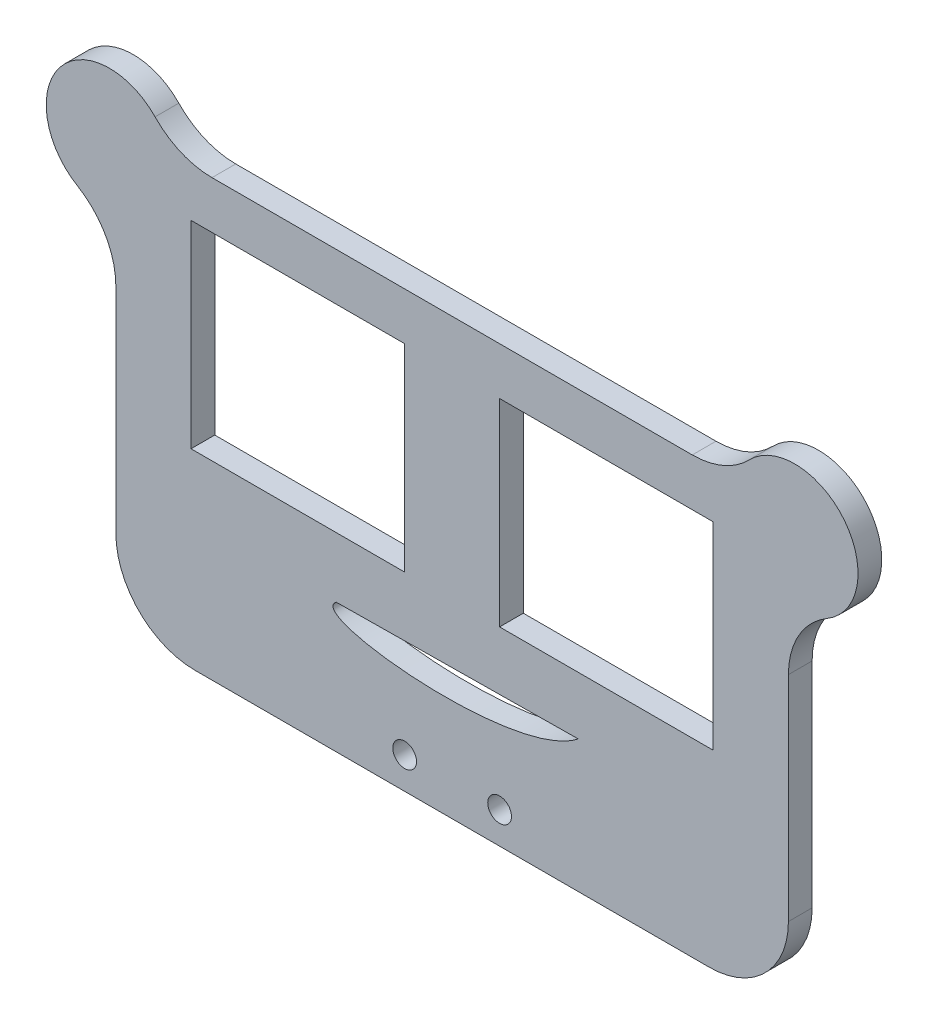
from build123d import *

# Parameters (mm, degrees)
SKETCH1_W               = 85
SKETCH1_H               = 55
BOSS_EXTRUDE2_DEPTH     = 3
CUT_EXTRUDE1_DEPTH      = 51.709959574
CUT_EXTRUDE1_DEPTH_BACK = 51.709959574
SKETCH3_W               = 27
SKETCH3_H               = 25
FILLET2_R               = 10
SKETCH4_R               = 8
BOSS_EXTRUDE3_DEPTH     = 3
FILLET3_R               = 10
CUT_EXTRUDE2_DEPTH      = 62.072254936
CUT_EXTRUDE2_DEPTH_BACK = 62.072254936
CUT_EXTRUDE3_DEPTH      = 62.072255079
CUT_EXTRUDE3_DEPTH_BACK = 62.072255079
SKETCH6_R               = 1.5


with BuildPart() as part:
    # Sketch1 → Boss-Extrude2 (new body)
    with BuildSketch(Plane.XY):
        Rectangle(SKETCH1_W, SKETCH1_H)
    extrude(amount=BOSS_EXTRUDE2_DEPTH)

    # Sketch3 → Cut-Extrude1 (cut, two sides: drawn at the far end of the back side and taken through both)
    with BuildSketch(Plane.XY.offset(3).offset(-CUT_EXTRUDE1_DEPTH_BACK)):
        with Locations((-19.5, 9)):
            Rectangle(SKETCH3_W, SKETCH3_H)
        with Locations((19.5, 9)):
            Rectangle(SKETCH3_W, SKETCH3_H)
    extrude(amount=CUT_EXTRUDE1_DEPTH + CUT_EXTRUDE1_DEPTH_BACK, mode=Mode.SUBTRACT)

    # Fillet2
    fillet2_edges = [part.edges().sort_by_distance(p)[0] for p in [
        (-42.5, -27.5, 1.5),
        (42.5, -27.5, 1.5),
    ]]
    fillet(fillet2_edges, radius=FILLET2_R)

    # Sketch4 → Boss-Extrude3 (add)
    with BuildSketch(Plane.XY):
        with Locations((-43.301270189, 25)):
            Circle(SKETCH4_R)
        with Locations((43.301270189, 25)):
            Circle(SKETCH4_R)
    extrude(amount=BOSS_EXTRUDE3_DEPTH)

    # Fillet3
    fillet3_edges = [part.edges().sort_by_distance(p)[0] for p in [
        (-35.701928112, 27.5, 1.5),
        (-42.5, 17.040228264, 1.5),
        (35.701928112, 27.5, 1.5),
        (42.5, 17.040228264, 1.5),
    ]]
    fillet(fillet3_edges, radius=FILLET3_R)

    # Sketch5 → Cut-Extrude2 (cut, two sides: drawn at the far end of the back side and taken through both)
    with BuildSketch(Plane.XY.offset(3).offset(-CUT_EXTRUDE2_DEPTH_BACK)):
        with BuildLine():
            Line((-14.657223741, -11.118605282), (15.937497294, -10.788446422))
            add(Edge.make_bspline(
                [(-14.657223741, -11.118605282), (-18.533826982, -14.187506868), (7.467986251, -17.149664061), (15.801657819, -10.897471716), (15.937497294, -10.788446422)],
                knots=[0, 0, 0, 0, 0.49190671, 0.50088311, 0.50088311, 0.50088311, 0.50088311], degree=3))
        make_face()
    extrude(amount=CUT_EXTRUDE2_DEPTH + CUT_EXTRUDE2_DEPTH_BACK, mode=Mode.SUBTRACT)

    # Sketch6 → Cut-Extrude3 (cut, two sides: drawn at the far end of the back side and taken through both)
    with BuildSketch(Plane.XY.offset(3).offset(-CUT_EXTRUDE3_DEPTH_BACK)):
        with Locations((-6, -23.5)):
            Circle(SKETCH6_R)
        with Locations((6, -23.5)):
            Circle(SKETCH6_R)
    extrude(amount=CUT_EXTRUDE3_DEPTH + CUT_EXTRUDE3_DEPTH_BACK, mode=Mode.SUBTRACT)


solid = part.part
